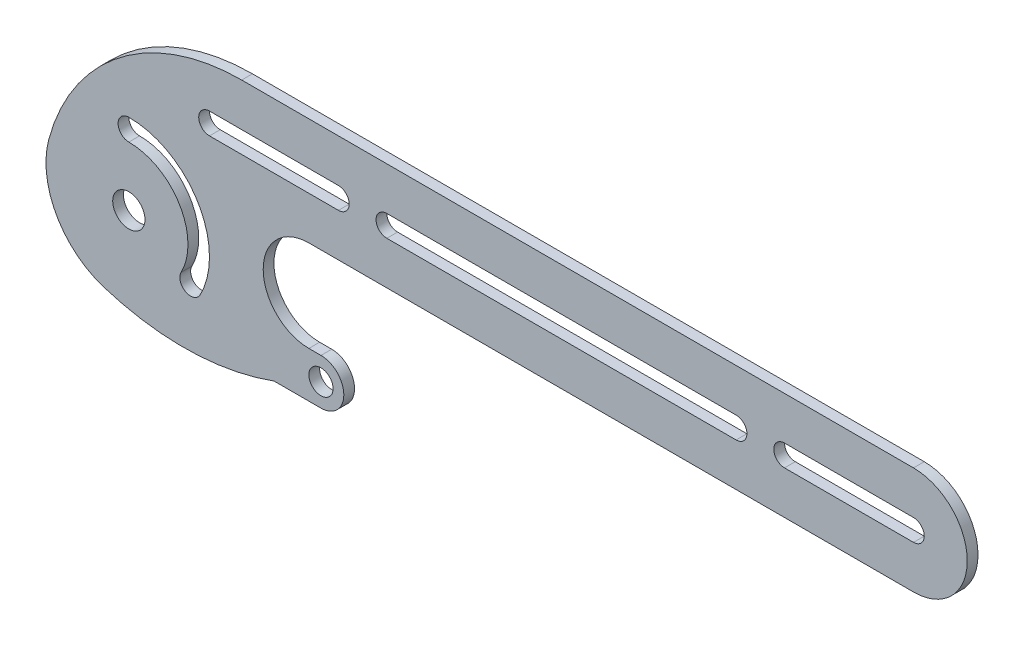
from build123d import *

# Parameters (mm, degrees)
ESQUISSE1_R        = 2.25
ESQUISSE1_R_2      = 3
BOSS_EXTRU_1_DEPTH = 1


with BuildPart() as part:
    # Esquisse1 → Boss.-Extru.1 (new, symmetric)
    with BuildSketch(Plane.XY):
        with BuildLine():
            Line((21, 31.5), (146, 31.5))
            ThreePointArc((146, 31.5), (156, 21.5), (146, 11.5))
            Line((146, 11.5), (33.5, 11.5))
            ThreePointArc((33.5, 11.5), (25, 3), (33.5, -5.5))
            Line((33.5, -5.5), (35.75, -5.5))
            ThreePointArc((35.75, -5.5), (40, -9.75), (35.75, -14))
            Line((35.75, -14), (27, -14))
            ThreePointArc((27, -14), (11.214469473, -16.988397735), (-4.686322253, -14.690938802))
            ThreePointArc((-4.686322253, -14.690938802), (-13.539380352, -7.380411831), (-14.886645987, 4.02157561))
            ThreePointArc((-14.886645987, 4.02157561), (-1.599309542, 23.841476371), (21, 31.5))
        make_face()
        with Locations((35.75, -9.75)):
            Circle(ESQUISSE1_R, mode=Mode.SUBTRACT)
        Circle(ESQUISSE1_R_2, mode=Mode.SUBTRACT)
        with BuildLine():
            Line((15, 23.5), (39, 23.5))
            ThreePointArc((39, 23.5), (41, 21.5), (39, 19.5))
            Line((39, 19.5), (15, 19.5))
            ThreePointArc((15, 19.5), (13, 21.5), (15, 23.5))
        make_face(mode=Mode.SUBTRACT)
        with BuildLine():
            Line((48, 23.5), (113, 23.5))
            ThreePointArc((113, 23.5), (115, 21.5), (113, 19.5))
            Line((113, 19.5), (48, 19.5))
            ThreePointArc((48, 19.5), (46, 21.5), (48, 23.5))
        make_face(mode=Mode.SUBTRACT)
        with BuildLine():
            Line((122, 23.5), (146, 23.5))
            ThreePointArc((146, 23.5), (148, 21.5), (146, 19.5))
            Line((146, 19.5), (122, 19.5))
            ThreePointArc((122, 19.5), (120, 21.5), (122, 23.5))
        make_face(mode=Mode.SUBTRACT)
        with BuildLine():
            ThreePointArc((13.266499161, -7), (12.845232579, 7.745966692), (0, 15))
            ThreePointArc((0, 15), (-2, 13), (0, 11))
            ThreePointArc((0, 11), (9.419837224, 5.680375574), (9.728766052, -5.133333333))
            ThreePointArc((9.728766052, -5.133333333), (10.564299273, -7.835533222), (13.266499161, -7))
        make_face(mode=Mode.SUBTRACT)
    extrude(amount=BOSS_EXTRU_1_DEPTH, both=True)


solid = part.part
